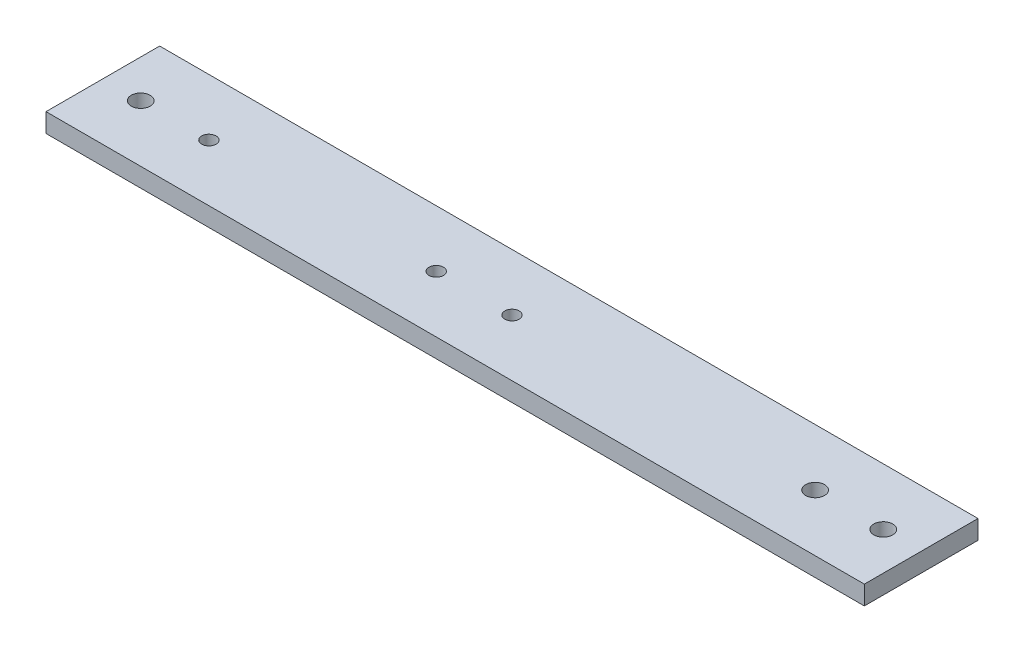
from build123d import *

# Parameters (mm, degrees)
SKETCH1_W           = 274.32
SKETCH1_H           = 38.1
SKETCH1_R           = 3.175
SKETCH1_R_2         = 2.413
BOSS_EXTRUDE1_DEPTH = 6.35


with BuildPart() as part:
    # Sketch1 → Boss-Extrude1 (new body)
    with BuildSketch(Plane(origin=(0, 0, 0), x_dir=(1, 0, 0), z_dir=(0, 1, 0))):
        Rectangle(SKETCH1_W, SKETCH1_H)
        with Locations(Location((-124.46, 0, 0), (0, 0, 270))):
            Circle(SKETCH1_R, mode=Mode.SUBTRACT)
        with Locations(Location((124.46, 0, 0), (0, 0, 270))):
            Circle(SKETCH1_R, mode=Mode.SUBTRACT)
        with Locations(Location((-101.6, 0, 0), (0, 0, 270))):
            Circle(SKETCH1_R_2, mode=Mode.SUBTRACT)
        with Locations(Location((-25.4, 0, 0), (0, 0, 270))):
            Circle(SKETCH1_R_2, mode=Mode.SUBTRACT)
        with Locations(Location((0, 0, 0), (0, 0, 270))):
            Circle(SKETCH1_R_2, mode=Mode.SUBTRACT)
        with Locations(Location((101.6, 0, 0), (0, 0, 270))):
            Circle(SKETCH1_R, mode=Mode.SUBTRACT)
    extrude(amount=BOSS_EXTRUDE1_DEPTH)


solid = part.part
